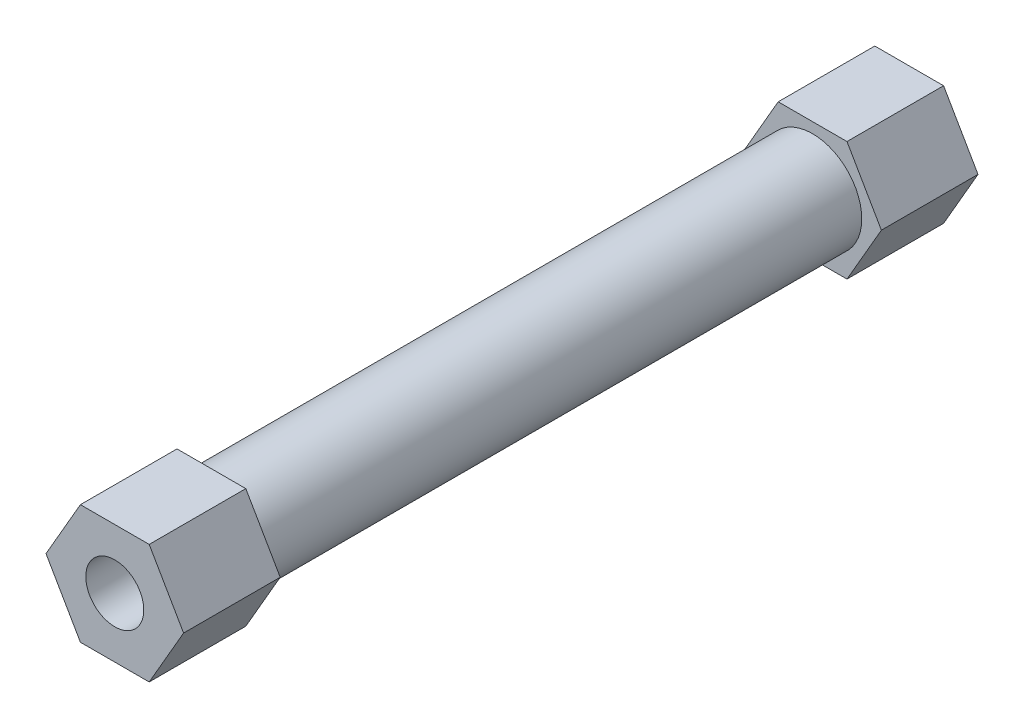
from build123d import *

# Parameters (mm, degrees)
Y_KSEKLIK_EKSTR_ZYON1_DEPTH = 37
KES_EKSTR_ZYON1_START       = -4.5
IZIM2_R                     = 3.29
IZIM2_R_2                   = 2.29
KES_EKSTR_ZYON1_DEPTH       = 28
IZIM3_R                     = 1.35
KES_EKSTR_ZYON2_DEPTH       = 38.242020958


with BuildPart() as part:
    # Çizim1 → Yükseklik-Ekstrüzyon1 (new body)
    with BuildSketch(Plane.XY):
        Polygon((1.602146997, -2.775), (3.204293994, 0), (1.602146997, 2.775), (-1.602146997, 2.775), (-3.204293994, 0), (-1.602146997, -2.775), align=None)
    extrude(amount=Y_KSEKLIK_EKSTR_ZYON1_DEPTH)

    # Çizim2 → Kes-Ekstrüzyon1 (cut)
    with BuildSketch(Plane.XY.offset(37).offset(KES_EKSTR_ZYON1_START)):
        Circle(IZIM2_R)
        Circle(IZIM2_R_2, mode=Mode.SUBTRACT)
    extrude(amount=-KES_EKSTR_ZYON1_DEPTH, mode=Mode.SUBTRACT)

    # Çizim3 → Kes-Ekstrüzyon2 (cut, through all)
    with BuildSketch(Plane(origin=(0, 0, 0), x_dir=(-1, 0, 0), z_dir=(0, 0, -1))):
        Circle(IZIM3_R)
    extrude(amount=-KES_EKSTR_ZYON2_DEPTH, mode=Mode.SUBTRACT)


solid = part.part
